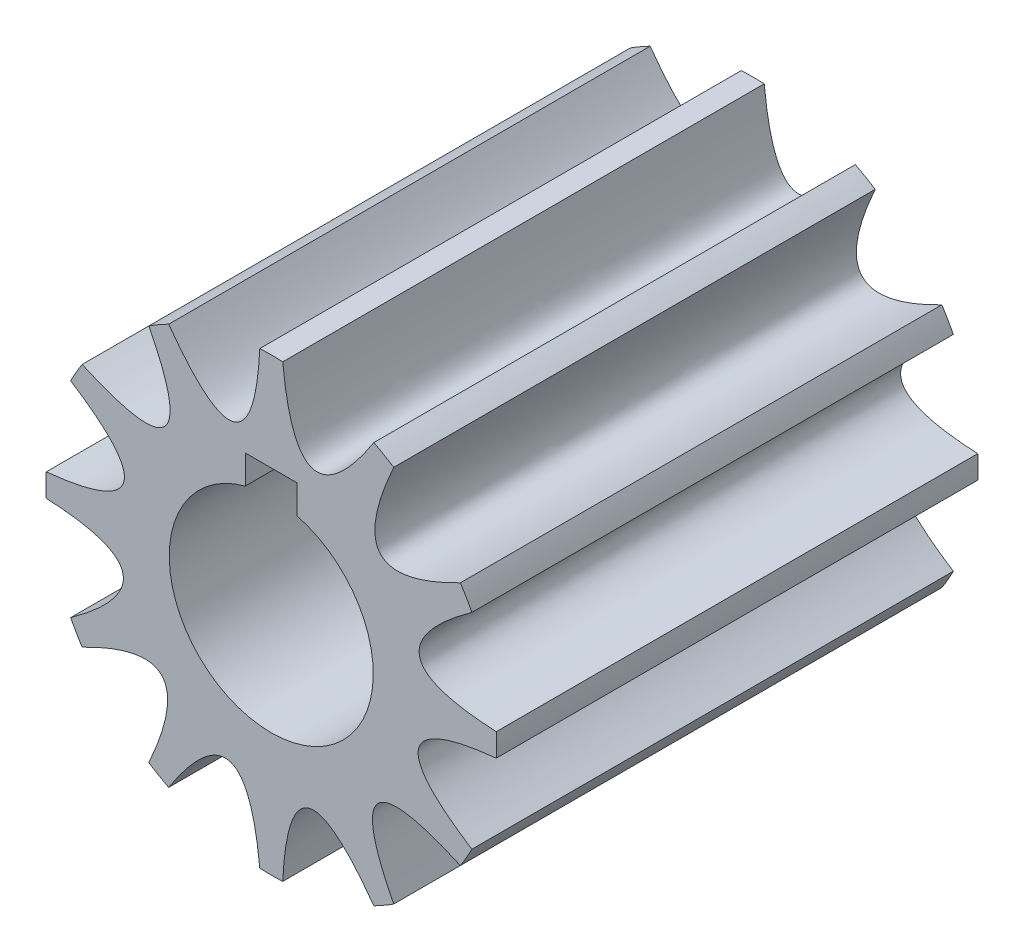
from build123d import *

# Parameters (mm, degrees)
BOSS_EXTRUDE1_DEPTH = 18.9992


with BuildPart() as part:
    # Sketch1 → Boss-Extrude1 (new body)
    with BuildSketch(Plane(origin=(0, 0, -9.4996), x_dir=(-1, 0, 0), z_dir=(0, 0, -1))):
        with BuildLine():
            ThreePointArc((-4.046742078, 7.915552874), (-4.444999971, 7.698965776), (-4.831698847, 7.462357872))
            add(Edge.make_bspline(
                [(-7.462357877, 4.831698842), (-2.486033618, 2.266053201), (-4.831698847, 7.462357872)],
                knots=[2.981650964, 2.981650964, 2.981650964, 3.304859407, 3.304859407, 3.304859407], degree=2, weights=[1, 0.986970431, 1]))
            ThreePointArc((-7.462357877, 4.831698842), (-7.698965785, 4.444999958), (-7.915552888, 4.046742057))
            add(Edge.make_bspline(
                [(-8.878440918, 0.453194985), (-3.285963409, 0.719349124), (-7.915552888, 4.046742057)],
                knots=[2.981536483, 2.981536483, 2.981536483, 3.304978035, 3.304978035, 3.304978035], degree=2, weights=[1, 0.986951671, 1]))
            ThreePointArc((-8.878440918, 0.453194985), (-8.889999934, -1.8e-08), (-8.878440916, -0.453195021))
            add(Edge.make_bspline(
                [(-7.915552875, -4.046742089), (-3.205402358, -1.020007084), (-8.878440916, -0.453195021)],
                knots=[2.981536493, 2.981536493, 2.981536493, 3.304978025, 3.304978025, 3.304978025], degree=2, weights=[1, 0.986951673, 1]))
            ThreePointArc((-7.915552875, -4.046742089), (-7.698965776, -4.444999983), (-7.462357871, -4.831698859))
            add(Edge.make_bspline(
                [(-4.831698833, -7.46235789), (-2.265956324, -2.486053227), (-7.462357871, -4.831698859)],
                knots=[6.123129138, 6.123129138, 6.123129138, 6.446570687, 6.446570687, 6.446570687], degree=2, weights=[1, 0.986951671, 1]))
            ThreePointArc((-4.831698833, -7.46235789), (-4.444999956, -7.698965793), (-4.046742062, -7.915552891))
            add(Edge.make_bspline(
                [(-0.45319499, -8.878440921), (-0.719349115, -3.285963407), (-4.046742062, -7.915552891)],
                knots=[2.981536467, 2.981536467, 2.981536467, 3.304978051, 3.304978051, 3.304978051], degree=2, weights=[1, 0.986951668, 1]))
            ThreePointArc((-0.45319499, -8.878440921), (1.3e-08, -8.889999937), (0.453195016, -8.87844092))
            add(Edge.make_bspline(
                [(4.046742084, -7.915552879), (1.02000708, -3.205402359), (0.453195016, -8.87844092)],
                knots=[2.98153649, 2.98153649, 2.98153649, 3.304978028, 3.304978028, 3.304978028], degree=2, weights=[1, 0.986951672, 1]))
            ThreePointArc((4.046742084, -7.915552879), (4.444999978, -7.698965779), (4.831698854, -7.462357875))
            add(Edge.make_bspline(
                [(7.462357885, -4.831698836), (2.486053224, -2.265956318), (4.831698854, -7.462357875)],
                knots=[2.981536473, 2.981536473, 2.981536473, 3.304978045, 3.304978045, 3.304978045], degree=2, weights=[1, 0.986951669, 1]))
            ThreePointArc((7.462357885, -4.831698836), (7.698965788, -4.444999959), (7.915552886, -4.046742065))
            add(Edge.make_bspline(
                [(8.878440916, -0.453194993), (3.285963404, -0.719349124), (7.915552886, -4.046742065)],
                knots=[6.123129127, 6.123129127, 6.123129127, 6.446570698, 6.446570698, 6.446570698], degree=2, weights=[1, 0.986951669, 1]))
            ThreePointArc((8.878440916, -0.453194993), (8.889999932, 1e-08), (8.878440915, 0.453195012))
            add(Edge.make_bspline(
                [(7.915552874, 4.046742081), (3.205402348, 1.020007083), (8.878440915, 0.453195012)],
                knots=[2.981536481, 2.981536481, 2.981536481, 3.304978038, 3.304978038, 3.304978038], degree=2, weights=[1, 0.986951671, 1]))
            ThreePointArc((7.915552874, 4.046742081), (7.698965774, 4.444999975), (7.46235787, 4.831698851))
            add(Edge.make_bspline(
                [(4.831698831, 7.462357882), (2.265956303, 2.486053223), (7.46235787, 4.831698851)],
                knots=[2.981536461, 2.981536461, 2.981536461, 3.304978057, 3.304978057, 3.304978057], degree=2, weights=[1, 0.986951667, 1]))
            ThreePointArc((4.831698831, 7.462357882), (4.444999954, 7.698965785), (4.04674206, 7.915552883))
            add(Edge.make_bspline(
                [(0.453194988, 8.878440913), (0.719349134, 3.285963406), (4.04674206, 7.915552883)],
                knots=[6.123129146, 6.123129146, 6.123129146, 6.446570679, 6.446570679, 6.446570679], degree=2, weights=[1, 0.986951673, 1]))
            ThreePointArc((0.453194988, 8.878440913), (-1.5e-08, 8.889999929), (-0.453195017, 8.878440911))
            add(Edge.make_bspline(
                [(-4.046742078, 7.915552874), (-1.020007093, 3.2054023), (-0.453195017, 8.878440911)],
                knots=[6.123129042, 6.123129042, 6.123129042, 6.446570785, 6.446570785, 6.446570785], degree=2, weights=[1, 0.986951656, 1]))
        make_face()
        with BuildLine():
            Line((-1.025400001, 3.892608376), (-1.025400001, 5.025399996))
            Line((-1.025400001, 5.025399996), (1.025399999, 5.025399996))
            Line((1.025399999, 5.025399996), (1.025399999, 3.892608376))
            ThreePointArc((1.025399999, 3.892608376), (-1e-09, -4.025400004), (-1.025400001, 3.892608376))
        make_face(mode=Mode.SUBTRACT)
    extrude(amount=-BOSS_EXTRUDE1_DEPTH)


solid = part.part
